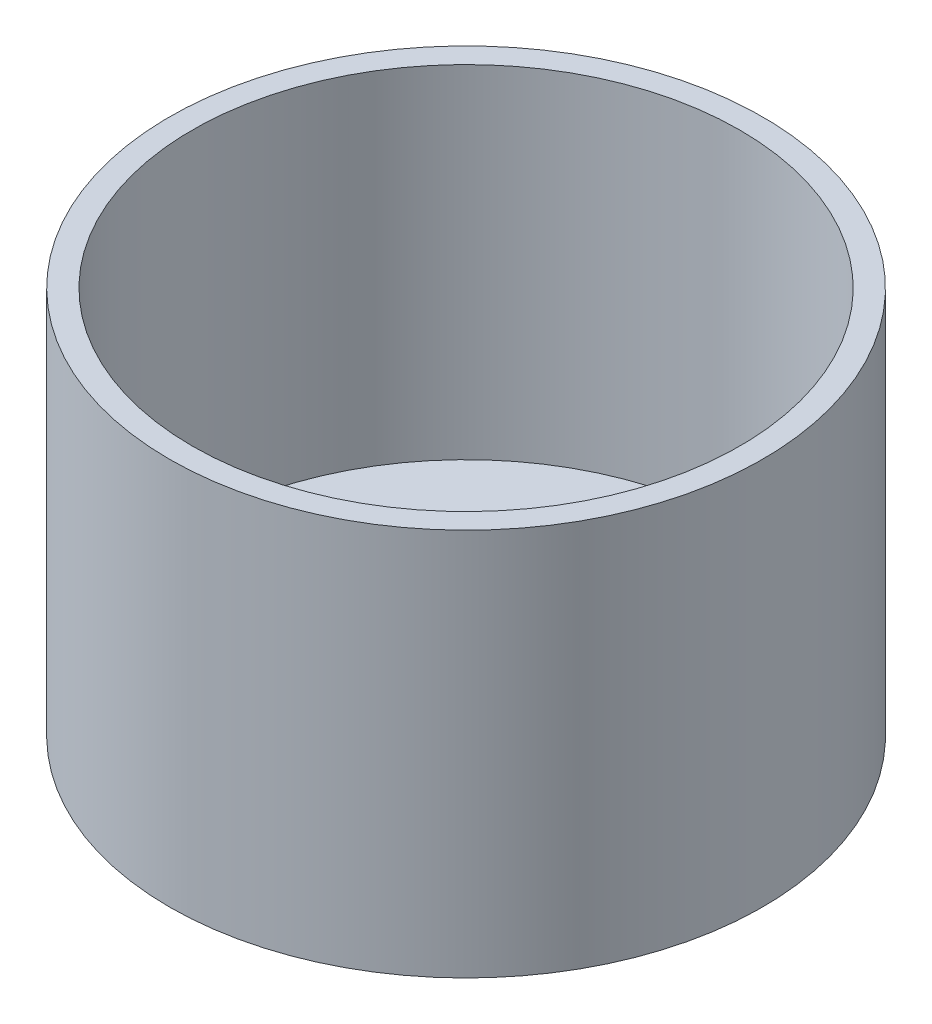
from build123d import *

# Parameters (mm, degrees)
SKETCH1_R           = 13
BOSS_EXTRUDE2_DEPTH = 2
SKETCH2_R           = 13
SKETCH2_R_2         = 12
BOSS_EXTRUDE3_DEPTH = 15
SKETCH3_R           = 5
CUT_EXTRUDE1_DEPTH  = 15


with BuildPart() as part:
    # Sketch1 → Boss-Extrude2 (new body)
    with BuildSketch(Plane(origin=(0, 0, 0), x_dir=(1, 0, 0), z_dir=(0, 1, 0))):
        with Locations(Location((0, 0, 0), (0, 0, 270))):
            Circle(SKETCH1_R)
    extrude(amount=BOSS_EXTRUDE2_DEPTH)

    # Sketch2 → Boss-Extrude3 (add)
    with BuildSketch(Plane(origin=(0, 2, 0), x_dir=(1, 0, 0), z_dir=(0, 1, 0))):
        with Locations(Location((0, 0, 0), (0, 0, 270))):
            Circle(SKETCH2_R)
        with Locations(Location((0, 0, 0), (0, 0, 270))):
            Circle(SKETCH2_R_2, mode=Mode.SUBTRACT)
    extrude(amount=BOSS_EXTRUDE3_DEPTH)

    # Sketch3 → Cut-Extrude1 (cut)
    with BuildSketch(Plane.XZ):
        with Locations(Location((0, 0, 0), (0, 0, 270))):
            Circle(SKETCH3_R)
    extrude(amount=-CUT_EXTRUDE1_DEPTH, mode=Mode.SUBTRACT)


solid = part.part
